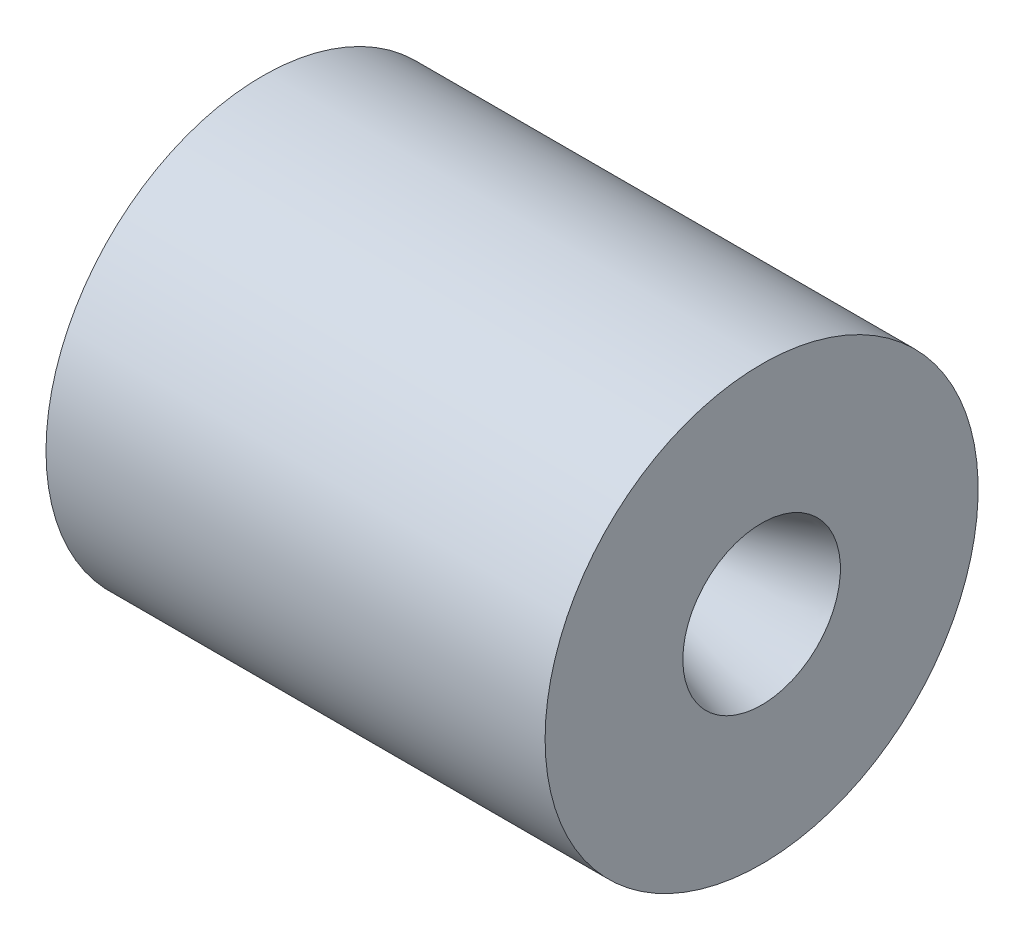
from build123d import *

# Parameters (mm, degrees)
CIRPATTERN1_COUNT = 15


with BuildPart() as part:
    # Model → Revolve1 (revolve)
    with BuildSketch(Plane.XY, mode=Mode.PRIVATE) as revolve1_sk:
        with BuildLine():
            Line((0, 55.140272), (23.150958, 55.140272))
            ThreePointArc((23.150958, 55.140272), (60.421138671, 50.233559208), (95.151418, 35.847806))
            Line((95.151418, 35.847806), (128.566947896, 16.55534082))
            ThreePointArc((128.566947896, 16.55534082), (133.553991718, 14.489639839), (138.905748896, 13.78506782))
            ThreePointArc((138.905748896, 13.78506782), (139.768990342, 13.856305516), (140.608875713, 14.068091181))
            add(Edge.make_bspline(
                [(140.608875713, 14.068091181), (181.460140896, 28.03089782), (185.649173896, 29.31027082)],
                knots=[0, 0, 0, 1, 1, 1], degree=2))
            Line((185.649173896, 29.31027082), (185.649173896, 80.540272))
            Line((185.649173896, 80.540272), (0, 80.540272))
            Line((0, 80.540272), (0, 55.140272))
        make_face()
    revolve(revolve1_sk.sketch.rotate(Axis((0, 0, 0), (1, 0, 0)), 90), axis=Axis((0, 0, 0), (1, 0, 0)))

    # Sketch3 → 13/64 (0.20313) Diameter Hole1 (revolve, cut)
    with BuildSketch(Plane(origin=(0, 0, 71.5), x_dir=(0, 0, 1), z_dir=(0, 1, 0))):
        Polygon((0, 0), (0, 14.250070783), (2.579751, 12.7), (2.579751, 0), align=None)
    f_13_64_0_20313_diameter_hole1 = revolve(axis=Axis((-6.35, 0, 71.5), (1, 0, 0)), mode=Mode.SUBTRACT)

    # CirPattern1: 13/64 (0.20313) Diameter Hole1 ×15 about axis
    cirpattern1_axis = Axis((0, 0, 0), (1, 0, 0))
    for i in range(1, CIRPATTERN1_COUNT):
        add(f_13_64_0_20313_diameter_hole1.rotate(cirpattern1_axis, i * 360 / CIRPATTERN1_COUNT), mode=Mode.SUBTRACT)


solid = part.part
